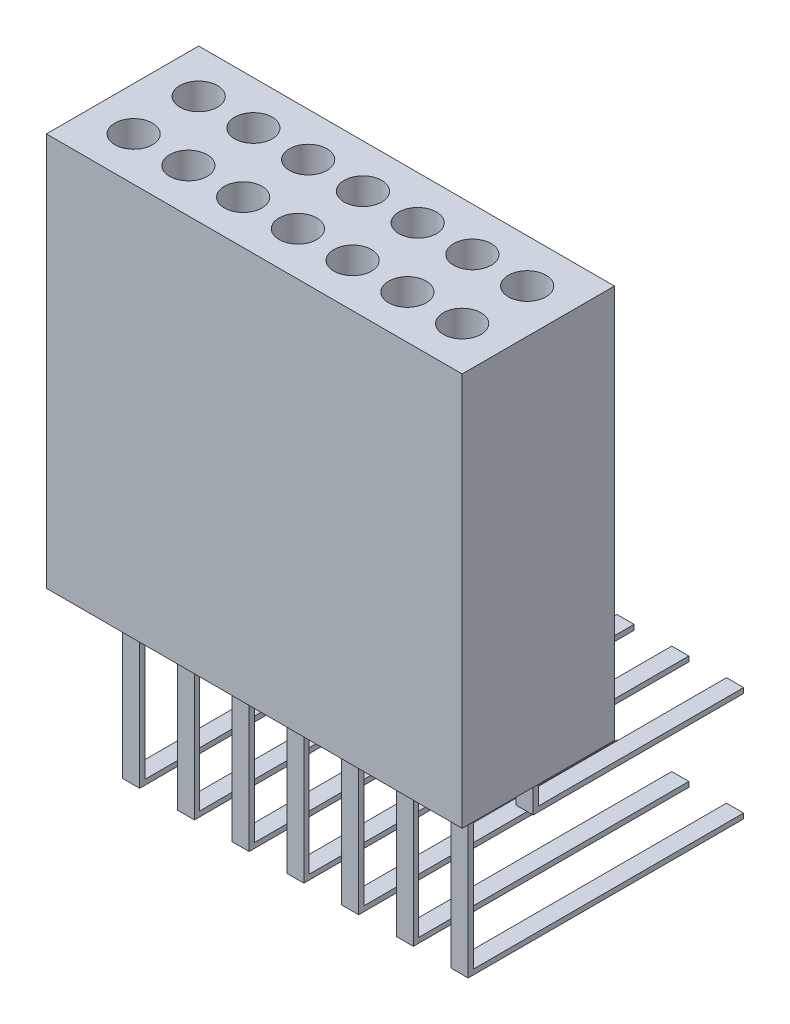
from build123d import *

# Parameters (mm, degrees)
SKETCH2_W           = 4.86
SKETCH2_H           = 1.78
BOSS_EXTRUDE1_DEPTH = 4.6
SKETCH3_R           = 0.22
CUT_EXTRUDE1_DEPTH  = 4.5
SKETCH4_W           = 0.2
SKETCH4_H           = 0.06
BOSS_EXTRUDE2_DEPTH = 1.96
SKETCH6_W           = 0.2
SKETCH6_H           = 0.06
BOSS_EXTRUDE3_DEPTH = 0.69
SKETCH7_W           = 0.2
SKETCH7_H           = 0.06
BOSS_EXTRUDE4_DEPTH = 2.4
SKETCH8_W           = 0.2
SKETCH8_H           = 0.06
BOSS_EXTRUDE5_DEPTH = 3.16


with BuildPart() as part:
    # Sketch2 → Boss-Extrude1 (new body)
    with BuildSketch(Plane(origin=(0, 0, 0), x_dir=(1, 0, 0), z_dir=(0, 1, 0))):
        with Locations((2.43, 0.89)):
            Rectangle(SKETCH2_W, SKETCH2_H)
    extrude(amount=BOSS_EXTRUDE1_DEPTH)

    # Sketch3 → Cut-Extrude1 (cut)
    with BuildSketch(Plane(origin=(0, 4.6, 0), x_dir=(1, 0, 0), z_dir=(0, 1, 0))):
        with Locations(Location((0.51, 1.27, 0), (0, 0, 270))):
            Circle(SKETCH3_R)
        with Locations(Location((1.15, 1.27, 0), (0, 0, 270))):
            Circle(SKETCH3_R)
        with Locations(Location((1.79, 1.27, 0), (0, 0, 270))):
            Circle(SKETCH3_R)
        with Locations(Location((2.43, 1.27, 0), (0, 0, 270))):
            Circle(SKETCH3_R)
        with Locations(Location((3.07, 1.27, 0), (0, 0, 270))):
            Circle(SKETCH3_R)
        with Locations(Location((3.71, 1.27, 0), (0, 0, 270))):
            Circle(SKETCH3_R)
        with Locations(Location((4.35, 1.27, 0), (0, 0, 270))):
            Circle(SKETCH3_R)
        with Locations(Location((1.15, 0.51, 0), (0, 0, 270))):
            Circle(SKETCH3_R)
        with Locations(Location((1.79, 0.51, 0), (0, 0, 270))):
            Circle(SKETCH3_R)
        with Locations(Location((2.43, 0.51, 0), (0, 0, 270))):
            Circle(SKETCH3_R)
        with Locations(Location((3.07, 0.51, 0), (0, 0, 270))):
            Circle(SKETCH3_R)
        with Locations(Location((3.71, 0.51, 0), (0, 0, 270))):
            Circle(SKETCH3_R)
        with Locations(Location((4.35, 0.51, 0), (0, 0, 270))):
            Circle(SKETCH3_R)
        with Locations(Location((0.51, 0.51, 0), (0, 0, 270))):
            Circle(SKETCH3_R)
    extrude(amount=-CUT_EXTRUDE1_DEPTH, mode=Mode.SUBTRACT)

    # Sketch4 → Boss-Extrude2 (add)
    with BuildSketch(Plane.XZ):
        with Locations((0.51, -0.51)):
            Rectangle(SKETCH4_W, SKETCH4_H)
        with Locations((1.15, -0.51)):
            Rectangle(SKETCH4_W, SKETCH4_H)
        with Locations((1.79, -0.51)):
            Rectangle(SKETCH4_W, SKETCH4_H)
        with Locations((2.43, -0.51)):
            Rectangle(SKETCH4_W, SKETCH4_H)
        with Locations((3.07, -0.51)):
            Rectangle(SKETCH4_W, SKETCH4_H)
        with Locations((3.71, -0.51)):
            Rectangle(SKETCH4_W, SKETCH4_H)
        with Locations((4.35, -0.51)):
            Rectangle(SKETCH4_W, SKETCH4_H)
    extrude(amount=BOSS_EXTRUDE2_DEPTH)

    # Sketch6 → Boss-Extrude3 (add)
    with BuildSketch(Plane.XZ):
        with Locations((0.51, -1.27)):
            Rectangle(SKETCH6_W, SKETCH6_H)
        with Locations((1.15, -1.27)):
            Rectangle(SKETCH6_W, SKETCH6_H)
        with Locations((1.79, -1.27)):
            Rectangle(SKETCH6_W, SKETCH6_H)
        with Locations((2.43, -1.27)):
            Rectangle(SKETCH6_W, SKETCH6_H)
        with Locations((3.07, -1.27)):
            Rectangle(SKETCH6_W, SKETCH6_H)
        with Locations((3.71, -1.27)):
            Rectangle(SKETCH6_W, SKETCH6_H)
        with Locations((4.35, -1.27)):
            Rectangle(SKETCH6_W, SKETCH6_H)
    extrude(amount=BOSS_EXTRUDE3_DEPTH)

    # Sketch7 → Boss-Extrude4 (add)
    with BuildSketch(Plane(origin=(0, 0, -1.3), x_dir=(-1, 0, 0), z_dir=(0, 0, -1))):
        with Locations((-4.35, -0.66)):
            Rectangle(SKETCH7_W, SKETCH7_H)
        with Locations((-3.71, -0.66)):
            Rectangle(SKETCH7_W, SKETCH7_H)
        with Locations((-3.07, -0.66)):
            Rectangle(SKETCH7_W, SKETCH7_H)
        with Locations((-2.43, -0.66)):
            Rectangle(SKETCH7_W, SKETCH7_H)
        with Locations((-1.79, -0.66)):
            Rectangle(SKETCH7_W, SKETCH7_H)
        with Locations((-1.15, -0.66)):
            Rectangle(SKETCH7_W, SKETCH7_H)
        with Locations((-0.51, -0.66)):
            Rectangle(SKETCH7_W, SKETCH7_H)
    extrude(amount=BOSS_EXTRUDE4_DEPTH)

    # Sketch8 → Boss-Extrude5 (add)
    with BuildSketch(Plane(origin=(0, 0, -0.54), x_dir=(-1, 0, 0), z_dir=(0, 0, -1))):
        with Locations((-4.35, -1.93)):
            Rectangle(SKETCH8_W, SKETCH8_H)
        with Locations((-3.71, -1.93)):
            Rectangle(SKETCH8_W, SKETCH8_H)
        with Locations((-3.07, -1.93)):
            Rectangle(SKETCH8_W, SKETCH8_H)
        with Locations((-2.43, -1.93)):
            Rectangle(SKETCH8_W, SKETCH8_H)
        with Locations((-1.79, -1.93)):
            Rectangle(SKETCH8_W, SKETCH8_H)
        with Locations((-1.15, -1.93)):
            Rectangle(SKETCH8_W, SKETCH8_H)
        with Locations((-0.51, -1.93)):
            Rectangle(SKETCH8_W, SKETCH8_H)
    extrude(amount=BOSS_EXTRUDE5_DEPTH)


solid = part.part
